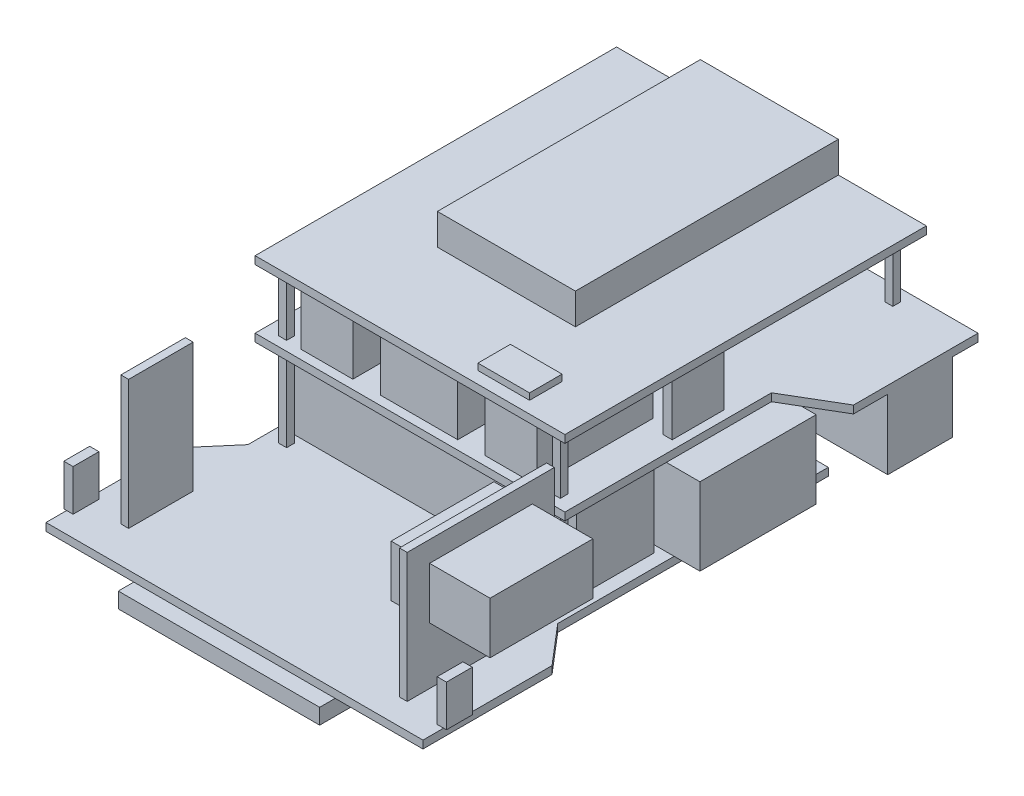
from build123d import *

# Parameters (mm, degrees)
BOSS_EXTRUDE1_DEPTH       = 3
SKETCH2_W                 = 3.05
SKETCH2_H                 = 3.05
BOSS_EXTRUDE2_DEPTH       = 33
SKETCH3_W                 = 120
SKETCH3_H                 = 140
BOSS_EXTRUDE3_DEPTH       = 3
SKETCH4_W                 = 3.05
SKETCH4_H                 = 3.05
BOSS_EXTRUDE4_DEPTH       = 23
SKETCH6_W                 = 120
SKETCH6_H                 = 140
BOSS_EXTRUDE5_DEPTH       = 3
SKETCH7_W                 = 68
SKETCH7_H                 = 25
BOSS_EXTRUDE6_DEPTH       = 27
SKETCH9_W                 = 58
SKETCH9_H                 = 60
SKETCH9_W_2               = 20
SKETCH9_H_2               = 45
SKETCH9_W_3               = 30
SKETCH9_H_3               = 50
BOSS_EXTRUDE7_DEPTH       = 20
SKETCH10_W                = 53.46
SKETCH10_H                = 101.85
BOSS_EXTRUDE8_DEPTH       = 12
SKETCH11_W                = 110
SKETCH11_H                = 30
BOSS_EXTRUDE9_DEPTH       = 32
SKETCH12_W                = 140
SKETCH12_H                = 45
BOSS_EXTRUDE10_DEPTH      = 30
SKETCH13_W                = 20
SKETCH13_H                = 12.6
BOSS_EXTRUDE11_DEPTH      = 2.5
SKETCH14_W                = 3.6
SKETCH14_H                = 20
BOSS_EXTRUDE12_DEPTH      = 20
SKETCH15_W                = 3.6
SKETCH15_H                = 10
BOSS_EXTRUDE13_DEPTH      = 16
SKETCH16_W                = 3
SKETCH16_H                = 57
SKETCH16_H_2              = 25
BOSS_EXTRUDE14_DEPTH      = 50
BOSS_EXTRUDE15_DEPTH      = 23.4
BOSS_EXTRUDE15_DEPTH_BACK = 14.9
SKETCH17_W                = 39.808487161
SKETCH17_H                = 20
SKETCH18_W                = 78
SKETCH18_H                = 25
BOSS_EXTRUDE16_DEPTH      = 6


with BuildPart() as part:
    # Sketch1 → Boss-Extrude1 (new body)
    with BuildSketch(Plane(origin=(0, 0, 0), x_dir=(1, 0, 0), z_dir=(0, 1, 0))):
        Polygon((-73, -35), (-60, -19.801315846), (-60, 85), (60, 85), (60, -19.801315846), (73, -35), (73, -85), (60, -85), (-60, -85), (-73, -85), align=None)
    extrude(amount=BOSS_EXTRUDE1_DEPTH)

    # Sketch2 → Boss-Extrude2 (add)
    with BuildSketch(Plane(origin=(0, 3, 0), x_dir=(1, 0, 0), z_dir=(0, 1, 0))):
        with Locations((-53, -11.81)):
            Rectangle(SKETCH2_W, SKETCH2_H)
        with Locations((53, -11.81)):
            Rectangle(SKETCH2_W, SKETCH2_H)
        with Locations((54, 75)):
            Rectangle(SKETCH2_W, SKETCH2_H)
        with Locations((-54, 75)):
            Rectangle(SKETCH2_W, SKETCH2_H)
    extrude(amount=BOSS_EXTRUDE2_DEPTH)

    # Sketch3 → Boss-Extrude3 (add)
    with BuildSketch(Plane(origin=(0, 36, 0), x_dir=(1, 0, 0), z_dir=(0, 1, 0))):
        Polygon((-80, 74.780305915), (-60, 62.99), (-60, 122.99), (-80, 122.99), align=None)
        with Locations((0, 52.99)):
            Rectangle(SKETCH3_W, SKETCH3_H)
        Polygon((60, 122.99), (60, 62.99), (80, 74.780305915), (80, 122.99), align=None)
    extrude(amount=BOSS_EXTRUDE3_DEPTH)

    # Sketch4 → Boss-Extrude4 (add)
    with BuildSketch(Plane(origin=(0, 39, 0), x_dir=(1, 0, 0), z_dir=(0, 1, 0))):
        with Locations((-53, -11.81)):
            Rectangle(SKETCH4_W, SKETCH4_H)
        with Locations((-53, 116.99)):
            Rectangle(SKETCH4_W, SKETCH4_H)
        with Locations((53, -11.81)):
            Rectangle(SKETCH4_W, SKETCH4_H)
        with Locations((53, 116.99)):
            Rectangle(SKETCH4_W, SKETCH4_H)
    extrude(amount=BOSS_EXTRUDE4_DEPTH)

    # Sketch6 → Boss-Extrude5 (add)
    with BuildSketch(Plane(origin=(0, 62, 0), x_dir=(1, 0, 0), z_dir=(0, 1, 0))):
        with Locations((0, 52.99)):
            Rectangle(SKETCH6_W, SKETCH6_H)
    extrude(amount=BOSS_EXTRUDE5_DEPTH)

    # Sketch7 → Boss-Extrude6 (add)
    with BuildSketch(Plane.XZ.offset(-36)):
        with Locations((-46, -100.53)):
            Rectangle(SKETCH7_W, SKETCH7_H)
        with Locations((46, -100.53)):
            Rectangle(SKETCH7_W, SKETCH7_H)
    extrude(amount=BOSS_EXTRUDE6_DEPTH)

    # Sketch9 → Boss-Extrude7 (add)
    with BuildSketch(Plane(origin=(0, 39, 0), x_dir=(1, 0, 0), z_dir=(0, 1, 0))):
        with Locations((-1.05, 85.88)):
            Rectangle(SKETCH9_W, SKETCH9_H)
        with Locations((-35.64, 8.98)):
            Rectangle(SKETCH9_W_2, SKETCH9_H_2)
        with Locations((35.64, 8.98)):
            Rectangle(SKETCH9_W_2, SKETCH9_H_2)
        with Locations((0, 11.48)):
            Rectangle(SKETCH9_W_3, SKETCH9_H_3)
    extrude(amount=BOSS_EXTRUDE7_DEPTH)

    # Sketch10 → Boss-Extrude8 (add)
    with BuildSketch(Plane(origin=(0, 65, 0), x_dir=(1, 0, 0), z_dir=(0, 1, 0))):
        with Locations((-0.81, 72.065)):
            Rectangle(SKETCH10_W, SKETCH10_H)
    extrude(amount=BOSS_EXTRUDE8_DEPTH)

    # Sketch11 → Boss-Extrude9 (add)
    with BuildSketch(Plane(origin=(0, 3, 0), x_dir=(1, 0, 0), z_dir=(0, 1, 0))):
        with Locations((0, 7.543684861)):
            Rectangle(SKETCH11_W, SKETCH11_H)
    extrude(amount=BOSS_EXTRUDE9_DEPTH)

    # Sketch12 → Boss-Extrude10 (add)
    with BuildSketch(Plane(origin=(0, 3, 0), x_dir=(1, 0, 0), z_dir=(0, 1, 0))):
        with Locations((0, 47.793183731)):
            Rectangle(SKETCH12_W, SKETCH12_H)
    extrude(amount=BOSS_EXTRUDE10_DEPTH)

    # Sketch13 → Boss-Extrude11 (add)
    with BuildSketch(Plane(origin=(0, 65, 0), x_dir=(1, 0, 0), z_dir=(0, 1, 0))):
        with Locations((31.68, -6.09)):
            Rectangle(SKETCH13_W, SKETCH13_H)
    extrude(amount=BOSS_EXTRUDE11_DEPTH)

    # Sketch14 → Boss-Extrude12 (add)
    with BuildSketch(Plane(origin=(0, 39, 0), x_dir=(1, 0, 0), z_dir=(0, 1, 0))):
        with Locations((54.75, 37.99)):
            Rectangle(SKETCH14_W, SKETCH14_H)
        with Locations((-54.75, 37.99)):
            Rectangle(SKETCH14_W, SKETCH14_H)
    extrude(amount=BOSS_EXTRUDE12_DEPTH)

    # Sketch15 → Boss-Extrude13 (add)
    with BuildSketch(Plane(origin=(0, 3, 0), x_dir=(1, 0, 0), z_dir=(0, 1, 0))):
        with Locations((72.3, -72)):
            Rectangle(SKETCH15_W, SKETCH15_H)
        with Locations((-72.3, -72)):
            Rectangle(SKETCH15_W, SKETCH15_H)
    extrude(amount=BOSS_EXTRUDE13_DEPTH)

    # Sketch16 → Boss-Extrude14 (add)
    with BuildSketch(Plane(origin=(0, 3, 0), x_dir=(1, 0, 0), z_dir=(0, 1, 0))):
        with Locations((55.5, -46.6)):
            Rectangle(SKETCH16_W, SKETCH16_H)
        with Locations((-56.5, -58.5)):
            Rectangle(SKETCH16_W, SKETCH16_H_2)
    extrude(amount=BOSS_EXTRUDE14_DEPTH)

    # Sketch17 → Boss-Extrude15 (add, two sides: drawn at the far end of the back side and taken through both)
    with BuildSketch(Plane(origin=(57, 0, 0), x_dir=(0, 0, -1), z_dir=(1, 0, 0)).offset(-BOSS_EXTRUDE15_DEPTH_BACK)):
        with Locations((-46.50705122, 35)):
            Rectangle(SKETCH17_W, SKETCH17_H)
    extrude(amount=BOSS_EXTRUDE15_DEPTH + BOSS_EXTRUDE15_DEPTH_BACK)

    # Sketch18 → Boss-Extrude16 (add)
    with BuildSketch(Plane.XZ):
        with Locations((0, 78.5)):
            Rectangle(SKETCH18_W, SKETCH18_H)
    extrude(amount=BOSS_EXTRUDE16_DEPTH)


solid = part.part
